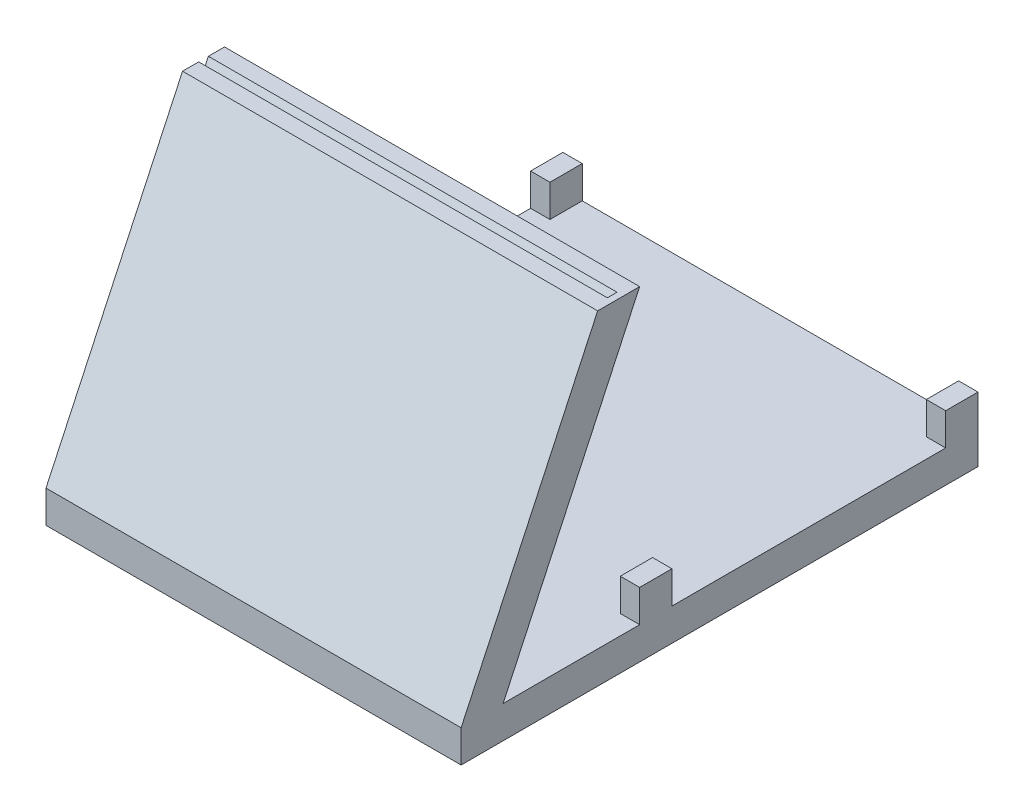
from build123d import *

# Parameters (mm, degrees)
SKETCH1_W           = 128.5
SKETCH1_H           = 160
BOSS_EXTRUDE1_DEPTH = 10
SKETCH6_W           = 6
SKETCH6_H           = 10
BOSS_EXTRUDE2_DEPTH = 10


with BuildPart() as part:
    # Sketch1 → Boss-Extrude1 (new body)
    with BuildSketch(Plane(origin=(0, 0, 0), x_dir=(1, 0, 0), z_dir=(0, 1, 0))):
        Rectangle(SKETCH1_W, SKETCH1_H)
    extrude(amount=BOSS_EXTRUDE1_DEPTH)

    # Sweep1: sweep along a path in Sketch4
    with BuildLine(Plane(origin=(64.25, 0, 0), x_dir=(0, 0, -1), z_dir=(1, 0, 0))) as sweep1_path:
        Line((-80, 10), (-37.738173826, 100.630778704))
    # Sketch2 → Sweep1 (sweep)
    with BuildSketch(Plane(origin=(0, 10, 0), x_dir=(1, 0, 0), z_dir=(0, 1, 0))):
        Polygon((-64.25, -80), (64.25, -80), (64.25, -67), (-64.25, -67), (-64.25, -72), (62.25, -72), (62.25, -75), (-64.25, -75), align=None)
    sweep(path=sweep1_path.line)

    # Sketch6 → Boss-Extrude2 (add)
    with BuildSketch(Plane(origin=(0, 10, 0), x_dir=(1, 0, 0), z_dir=(0, 1, 0))):
        with Locations((-61.25, 75)):
            Rectangle(SKETCH6_W, SKETCH6_H)
        with Locations((-61.25, -19.738173826)):
            Rectangle(SKETCH6_W, SKETCH6_H)
        with Locations((61.25, 75)):
            Rectangle(SKETCH6_W, SKETCH6_H)
        with Locations((61.25, -19.738173826)):
            Rectangle(SKETCH6_W, SKETCH6_H)
    extrude(amount=BOSS_EXTRUDE2_DEPTH)


solid = part.part
